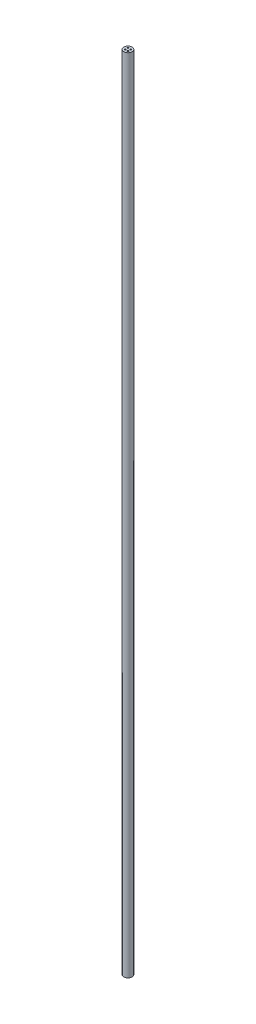
from build123d import *

# Parameters (mm, degrees)
SKETCH1_R           = 0.7874
SKETCH1_R_2         = 0.127
BOSS_EXTRUDE1_DEPTH = 152.4


with BuildPart() as part:
    # Sketch1 → Boss-Extrude1 (new body)
    with BuildSketch(Plane(origin=(0, 0, 0), x_dir=(1, 0, 0), z_dir=(0, 1, 0))):
        with Locations(Location((0, 0, 0), (0, 0, 270))):
            Circle(SKETCH1_R)
        with Locations(Location((-0.254, 0.254, 0), (0, 0, 270))):
            Circle(SKETCH1_R_2, mode=Mode.SUBTRACT)
        with Locations(Location((0.254, 0.254, 0), (0, 0, 270))):
            Circle(SKETCH1_R_2, mode=Mode.SUBTRACT)
        with Locations(Location((-0.254, -0.254, 0), (0, 0, 270))):
            Circle(SKETCH1_R_2, mode=Mode.SUBTRACT)
        with Locations(Location((0.254, -0.254, 0), (0, 0, 270))):
            Circle(SKETCH1_R_2, mode=Mode.SUBTRACT)
    extrude(amount=-BOSS_EXTRUDE1_DEPTH)


solid = part.part
